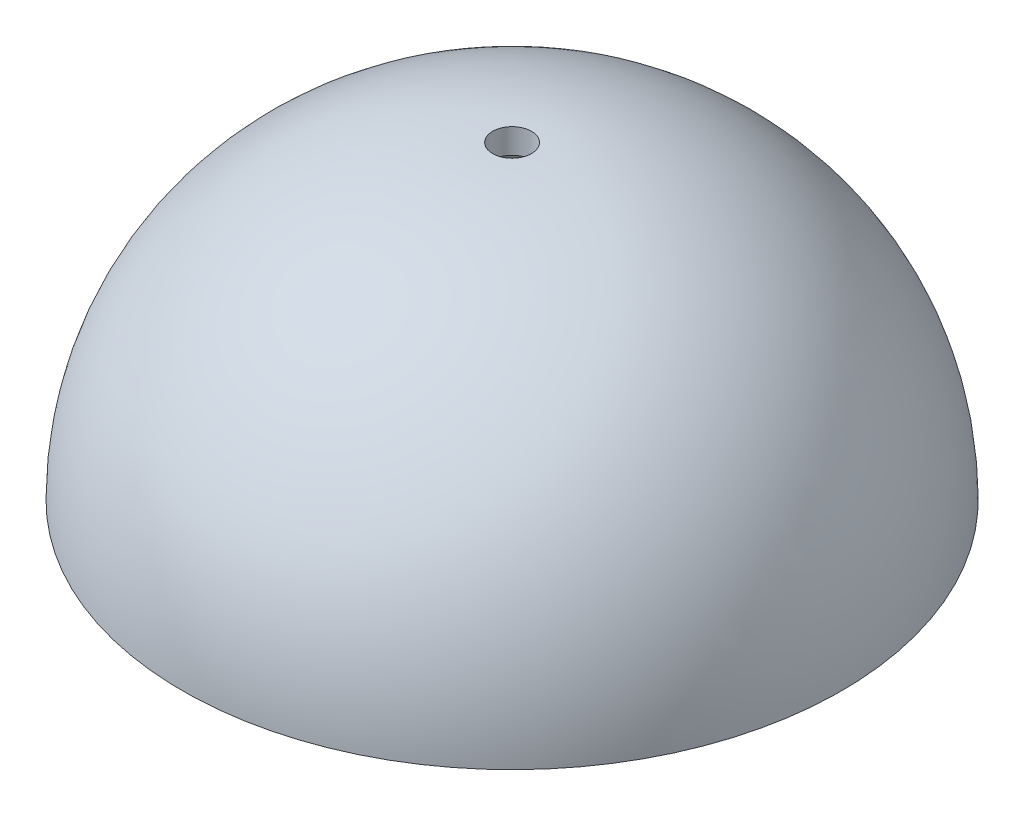
from build123d import *


with BuildPart() as part:
    # Sketch1 → Revolve5 (revolve)
    with BuildSketch(Plane.XY, mode=Mode.PRIVATE) as revolve5_sk:
        with BuildLine():
            Line((-0.000563715, 11.684000156), (-0.000563715, 12.700000156))
            ThreePointArc((-0.000563715, 12.700000156), (8.974713965, 8.982318415), (12.692395706, 0.007040735))
            Line((12.692395706, 0.007040735), (11.676395706, 0.007040735))
            ThreePointArc((11.676395706, 0.007040735), (8.256293475, 8.263897926), (-0.000563715, 11.684000156))
        make_face()
    revolve(revolve5_sk.sketch.rotate(Axis((-0.794313715, 0.007042532, 0), (0, 1, 0)), 90), axis=Axis((-0.794313715, 0.007042532, 0), (0, 1, 0)))


solid = part.part
